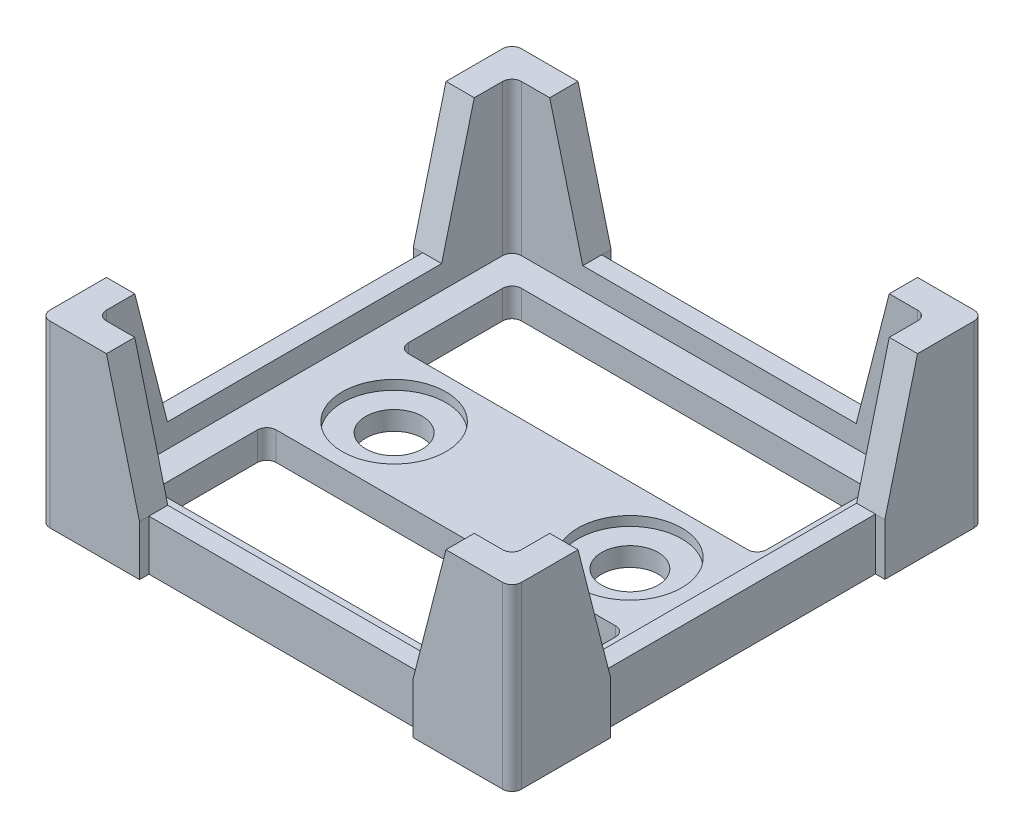
from build123d import *

# Parameters (mm, degrees)
SKETCH1_W                      = 50
SKETCH1_H                      = 50
BOSS_EXTRUDE1_DEPTH            = 19
SKETCH2_W                      = 44
SKETCH2_H                      = 44
CUT_EXTRUDE1_DEPTH             = 16
CBORE_FOR_M6_SHCS1_D           = 6
CBORE_FOR_M6_SHCS1_CBORE_D     = 11
CBORE_FOR_M6_SHCS1_CBORE_DEPTH = 1
SKETCH6_W                      = 38
SKETCH6_H                      = 12
CUT_EXTRUDE2_DEPTH             = 16
FILLET1_R                      = 1
FILLET3_R                      = 1
CUT_EXTRUDE3_DEPTH             = 60.042357677
CUT_EXTRUDE4_DEPTH             = 60.042357677
SKETCH9_W                      = 1
SKETCH9_H                      = 29.077623466
CUT_EXTRUDE5_DEPTH             = 10
SKETCH10_W                     = 28.99096046
SKETCH10_H                     = 1
CUT_EXTRUDE6_DEPTH             = 10
SKETCH11_W                     = 28.99096046
SKETCH11_H                     = 1
CUT_EXTRUDE7_DEPTH             = 10
SKETCH12_W                     = 1
SKETCH12_H                     = 29.077623466
CUT_EXTRUDE8_DEPTH             = 10


with BuildPart() as part:
    # Sketch1 → Boss-Extrude1 (new body)
    with BuildSketch(Plane(origin=(0, 0, 0), x_dir=(1, 0, 0), z_dir=(0, 1, 0))):
        Rectangle(SKETCH1_W, SKETCH1_H)
    extrude(amount=BOSS_EXTRUDE1_DEPTH)

    # Sketch2 → Cut-Extrude1 (cut)
    with BuildSketch(Plane(origin=(0, 19, 0), x_dir=(1, 0, 0), z_dir=(0, 1, 0))):
        Rectangle(SKETCH2_W, SKETCH2_H)
    extrude(amount=-CUT_EXTRUDE1_DEPTH, mode=Mode.SUBTRACT)

    # CBORE for M6 SHCS1 (through all)
    with Locations(Plane(origin=(-12.5, 3, 0), x_dir=(0, 0, 1), z_dir=(0, 1, 0))):
        with Locations((0, 0), (0, 25)):
            CounterBoreHole(CBORE_FOR_M6_SHCS1_D / 2, CBORE_FOR_M6_SHCS1_CBORE_D / 2, CBORE_FOR_M6_SHCS1_CBORE_DEPTH)

    # Sketch6 → Cut-Extrude2 (cut)
    with BuildSketch(Plane(origin=(0, 3, 0), x_dir=(1, 0, 0), z_dir=(0, 1, 0))):
        with Locations((0, -13)):
            Rectangle(SKETCH6_W, SKETCH6_H)
        with Locations((0, 13)):
            Rectangle(SKETCH6_W, SKETCH6_H)
    extrude(amount=-CUT_EXTRUDE2_DEPTH, mode=Mode.SUBTRACT)

    # Fillet1
    fillet1_edges = [part.edges().sort_by_distance(p)[0] for p in [
        (-22, 11, 22),
        (-22, 11, -22),
        (22, 11, -22),
        (22, 11, 22),
        (-19, 1.5, 19),
        (-19, 1.5, 7),
        (19, 1.5, 7),
        (19, 1.5, 19),
        (-19, 1.5, -7),
        (-19, 1.5, -19),
        (19, 1.5, -19),
        (19, 1.5, -7),
    ]]
    fillet(fillet1_edges, radius=FILLET1_R)

    # Fillet3
    fillet3_edges = [part.edges().sort_by_distance(p)[0] for p in [
        (-25, 9.5, -25),
        (25, 9.5, -25),
        (25, 9.5, 25),
        (-25, 9.5, 25),
    ]]
    fillet(fillet3_edges, radius=FILLET3_R)

    # Sketch7 → Cut-Extrude3 (cut, through all)
    with BuildSketch(Plane(origin=(25, 0, 0), x_dir=(0, 0, -1), z_dir=(1, 0, 0))):
        Polygon((14.538811733, 5.5), (-14.538811733, 5.5), (-18, 19), (18, 19), align=None)
    extrude(amount=-CUT_EXTRUDE3_DEPTH, mode=Mode.SUBTRACT)

    # Sketch8 → Cut-Extrude4 (cut, through all)
    with BuildSketch(Plane.XY.offset(25)):
        Polygon((-18, 19), (18, 19), (14.49548023, 5.330990042), (-14.49548023, 5.330990042), align=None)
    extrude(amount=-CUT_EXTRUDE4_DEPTH, mode=Mode.SUBTRACT)

    # Sketch9 → Cut-Extrude5 (cut)
    with BuildSketch(Plane(origin=(0, 5.5, 0), x_dir=(1, 0, 0), z_dir=(0, 1, 0))):
        with Locations((24.5, 0)):
            Rectangle(SKETCH9_W, SKETCH9_H)
    extrude(amount=-CUT_EXTRUDE5_DEPTH, mode=Mode.SUBTRACT)

    # Sketch10 → Cut-Extrude6 (cut)
    with BuildSketch(Plane(origin=(0, 5.330990042, 0), x_dir=(1, 0, 0), z_dir=(0, 1, 0))):
        with Locations((0, -24.5)):
            Rectangle(SKETCH10_W, SKETCH10_H)
    extrude(amount=-CUT_EXTRUDE6_DEPTH, mode=Mode.SUBTRACT)

    # Sketch11 → Cut-Extrude7 (cut)
    with BuildSketch(Plane(origin=(0, 5.330990042, 0), x_dir=(1, 0, 0), z_dir=(0, 1, 0))):
        with Locations((0, 24.5)):
            Rectangle(SKETCH11_W, SKETCH11_H)
    extrude(amount=-CUT_EXTRUDE7_DEPTH, mode=Mode.SUBTRACT)

    # Sketch12 → Cut-Extrude8 (cut)
    with BuildSketch(Plane(origin=(0, 5.5, 0), x_dir=(1, 0, 0), z_dir=(0, 1, 0))):
        with Locations((-24.5, 0)):
            Rectangle(SKETCH12_W, SKETCH12_H)
    extrude(amount=-CUT_EXTRUDE8_DEPTH, mode=Mode.SUBTRACT)


solid = part.part
